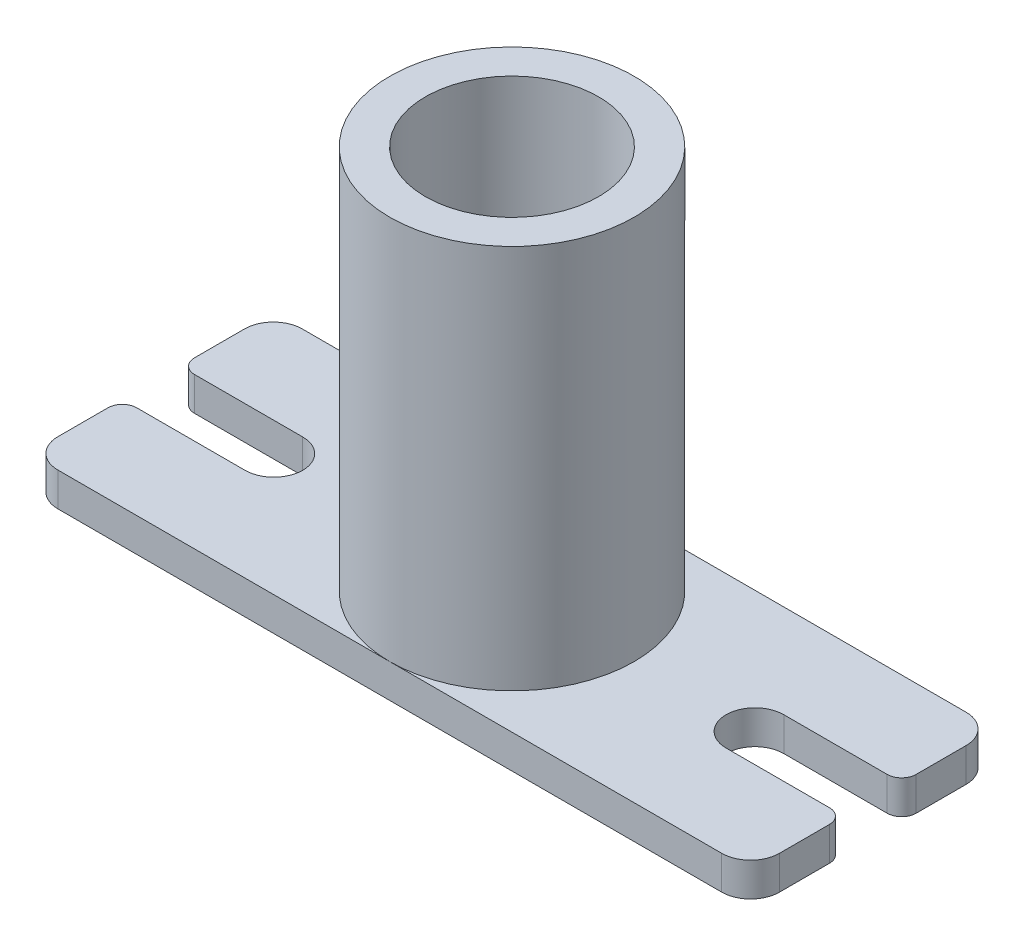
from build123d import *

# Parameters (mm, degrees)
BOSS_EXTRUDE2_DEPTH = 3.5
SKETCH4_R           = 12.7
BOSS_EXTRUDE3_DEPTH = 15
SKETCH5_R           = 12.7
SKETCH5_R_2         = 9
BOSS_EXTRUDE4_DEPTH = 25


with BuildPart() as part:
    # Sketch1 → Boss-Extrude2 (new body)
    with BuildSketch(Plane(origin=(0, 0, 0), x_dir=(1, 0, 0), z_dir=(0, 1, 0))):
        with BuildLine():
            Line((64.453053112, 11.100827963), (75.203053112, 11.100827963))
            ThreePointArc((75.203053112, 11.100827963), (76.263713284, 11.540167791), (76.703053112, 12.600827963))
            Line((76.703053112, 12.600827963), (76.703053112, 17.800827963))
            ThreePointArc((76.703053112, 17.800827963), (75.824373455, 19.922148306), (73.703053112, 20.800827963))
            Line((73.703053112, 20.800827963), (4.703053112, 20.800827963))
            ThreePointArc((4.703053112, 20.800827963), (2.581732768, 19.922148306), (1.703053112, 17.800827963))
            Line((1.703053112, 17.800827963), (1.703053112, 12.600827963))
            ThreePointArc((1.703053112, 12.600827963), (2.14239294, 11.540167791), (3.203053112, 11.100827963))
            Line((3.203053112, 11.100827963), (14.453053112, 11.100827963))
            ThreePointArc((14.453053112, 11.100827963), (17.453053112, 8.100827963), (14.453053112, 5.100827963))
            Line((14.453053112, 5.100827963), (3.203053112, 5.100827963))
            ThreePointArc((3.203053112, 5.100827963), (2.14239294, 4.661488134), (1.703053112, 3.600827963))
            Line((1.703053112, 3.600827963), (1.703053112, -1.599172037))
            ThreePointArc((1.703053112, -1.599172037), (2.581732768, -3.720492381), (4.703053112, -4.599172037))
            Line((4.703053112, -4.599172037), (73.703053112, -4.599172037))
            ThreePointArc((73.703053112, -4.599172037), (75.824373455, -3.720492381), (76.703053112, -1.599172037))
            Line((76.703053112, -1.599172037), (76.703053112, 3.600827963))
            ThreePointArc((76.703053112, 3.600827963), (76.263713284, 4.661488134), (75.203053112, 5.100827963))
            Line((75.203053112, 5.100827963), (64.453053112, 5.100827963))
            ThreePointArc((64.453053112, 5.100827963), (61.453053112, 8.100827963), (64.453053112, 11.100827963))
        make_face()
    extrude(amount=BOSS_EXTRUDE2_DEPTH)

    # Sketch4 → Boss-Extrude3 (add)
    with BuildSketch(Plane(origin=(0, 3.5, 0), x_dir=(1, 0, 0), z_dir=(0, 1, 0))):
        with Locations(Location((39.203053112, 8.100827963, 0), (0, 0, 270))):
            Circle(SKETCH4_R)
    extrude(amount=BOSS_EXTRUDE3_DEPTH)

    # Sketch5 → Boss-Extrude4 (add)
    with BuildSketch(Plane(origin=(0, 18.5, 0), x_dir=(1, 0, 0), z_dir=(0, 1, 0))):
        with Locations(Location((39.203053112, 8.100827963, 0), (0, 0, 270))):
            Circle(SKETCH5_R)
        with Locations(Location((39.203053112, 8.100827963, 0), (0, 0, 270))):
            Circle(SKETCH5_R_2, mode=Mode.SUBTRACT)
    extrude(amount=BOSS_EXTRUDE4_DEPTH)


solid = part.part
